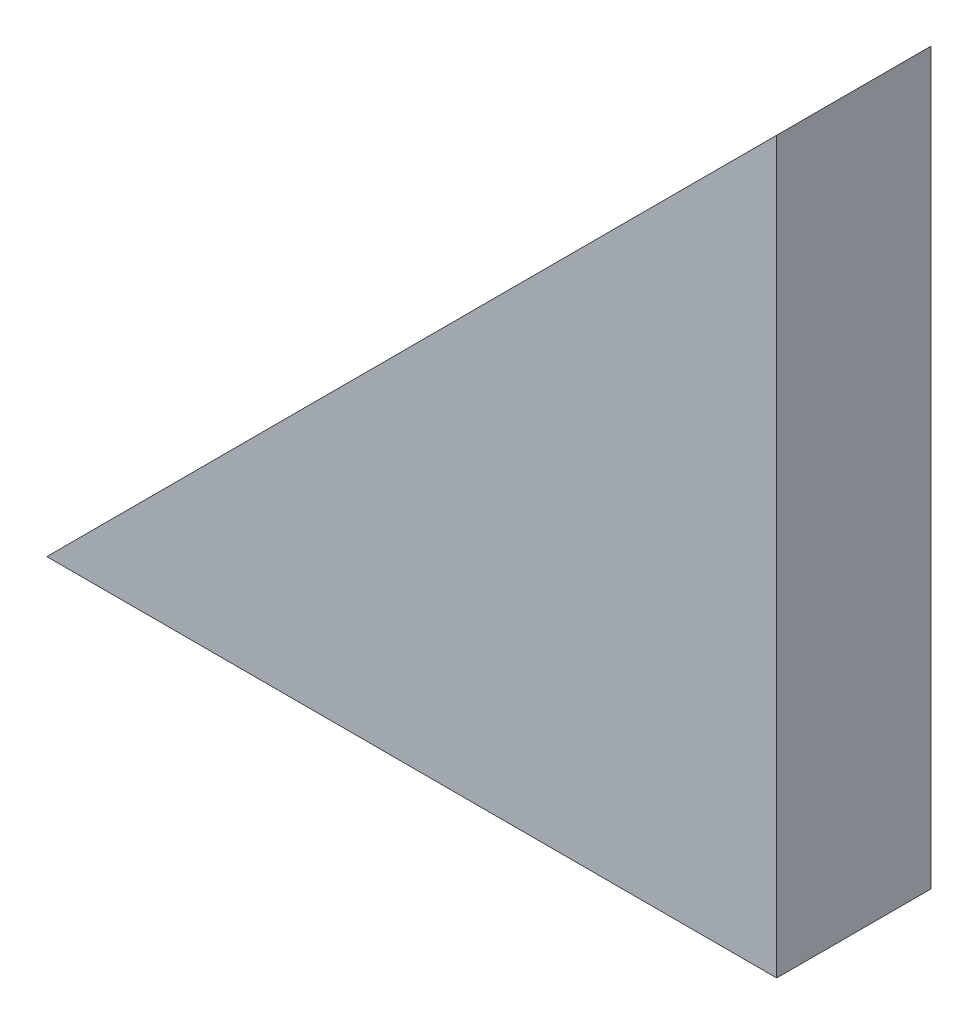
from build123d import *

# Parameters (mm, degrees)
SALIENTE_EXTRUIR1_DEPTH = 9.525


with BuildPart() as part:
    # Croquis1 → Saliente-Extruir1 (new body)
    with BuildSketch(Plane.XY):
        Polygon((0, 0), (-45, 0), (0, 45), align=None)
    extrude(amount=SALIENTE_EXTRUIR1_DEPTH)


solid = part.part
